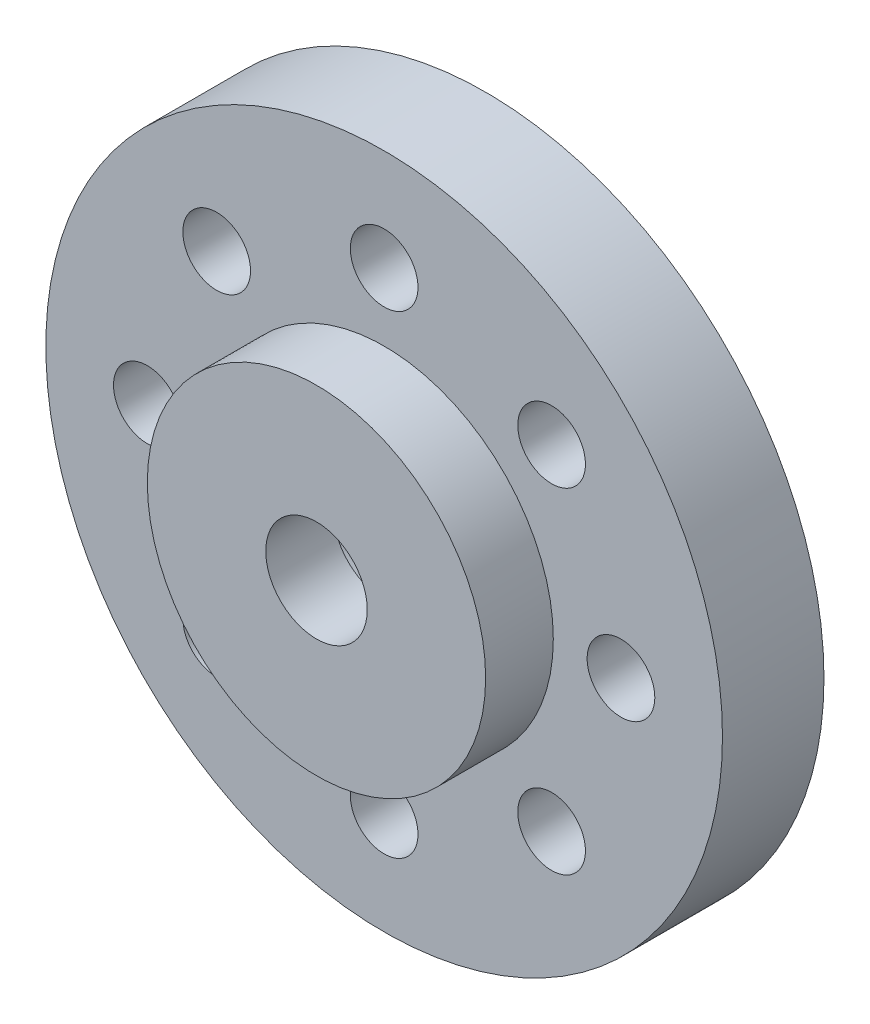
from build123d import *

# Parameters (mm, degrees)
SKETCH_1_R      = 10
SKETCH_1_R_2    = 3
SKETCH_1_R_3    = 1
EXTRUDE_1_DEPTH = 3
SKETCH_2_R      = 5
SKETCH_2_R_2    = 1.5
EXTRUDE_2_DEPTH = 2


with BuildPart() as part:
    # 草图1 → 凸台-拉伸1 (new body)
    with BuildSketch(Plane.XY):
        Circle(SKETCH_1_R)
        Circle(SKETCH_1_R_2, mode=Mode.SUBTRACT)
        with Locations((7, 0)):
            Circle(SKETCH_1_R_3, mode=Mode.SUBTRACT)
        with Locations((4.949747468, -4.949747468)):
            Circle(SKETCH_1_R_3, mode=Mode.SUBTRACT)
        with Locations((0, -7)):
            Circle(SKETCH_1_R_3, mode=Mode.SUBTRACT)
        with Locations((-4.949747468, -4.949747468)):
            Circle(SKETCH_1_R_3, mode=Mode.SUBTRACT)
        with Locations((-7, 0)):
            Circle(SKETCH_1_R_3, mode=Mode.SUBTRACT)
        with Locations((-4.949747468, 4.949747468)):
            Circle(SKETCH_1_R_3, mode=Mode.SUBTRACT)
        with Locations((0, 7)):
            Circle(SKETCH_1_R_3, mode=Mode.SUBTRACT)
        with Locations((4.949747468, 4.949747468)):
            Circle(SKETCH_1_R_3, mode=Mode.SUBTRACT)
    extrude(amount=EXTRUDE_1_DEPTH)

    # 草图2 → 凸台-拉伸2 (add)
    with BuildSketch(Plane.XY.offset(3)):
        Circle(SKETCH_2_R)
        Circle(SKETCH_2_R_2, mode=Mode.SUBTRACT)
    extrude(amount=EXTRUDE_2_DEPTH)


solid = part.part
